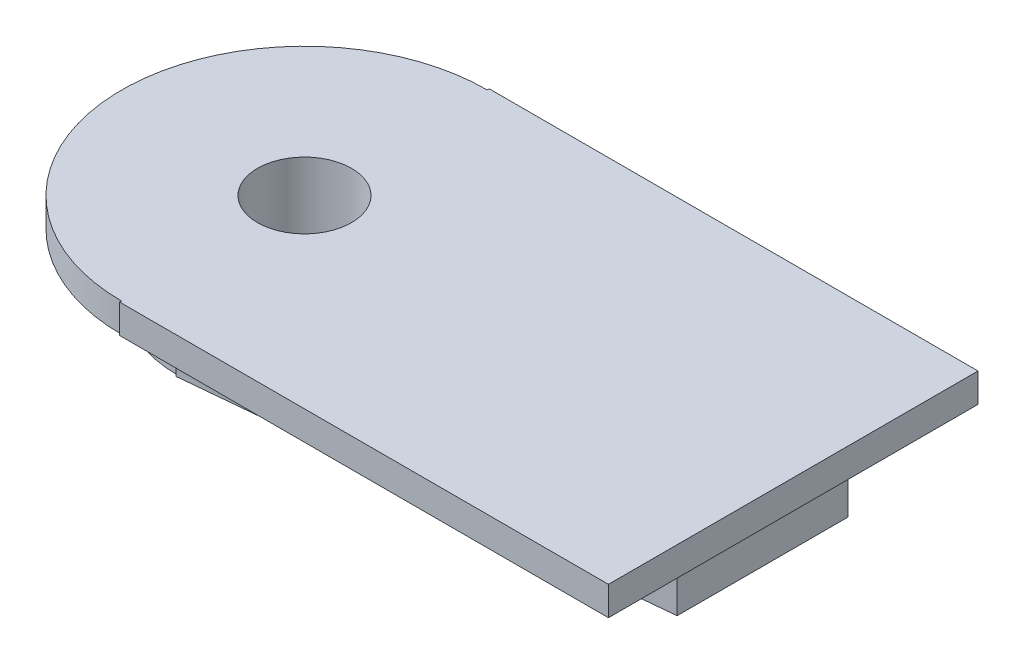
from build123d import *

# Parameters (mm, degrees)
BOSS_EXTRUDE1_START = 22.625
SKETCH1_R           = 3.5
BOSS_EXTRUDE1_DEPTH = 0.875
BOSS_EXTRUDE2_START = 22.625
BOSS_EXTRUDE2_DEPTH = 0.875
BOSS_EXTRUDE3_START = 23.9
SKETCH3_R           = 5.05
BOSS_EXTRUDE3_DEPTH = 0.4
BOSS_EXTRUDE4_START = 23.9
SKETCH4_W           = 13.5
SKETCH4_H           = 10.207569722
BOSS_EXTRUDE4_DEPTH = 0.4
CUT_EXTRUDE1_START  = 23.025
SKETCH5_R           = 1.3
CUT_EXTRUDE1_DEPTH  = 1.275


with BuildPart() as part:
    # Sketch1 → Boss-Extrude1 (new, symmetric)
    with BuildSketch(Plane(origin=(0, 0, 0), x_dir=(1, 0, 0), z_dir=(0, 1, 0)).offset(BOSS_EXTRUDE1_START)):
        with Locations(Location((0, 0, 0), (0, 0, 270))):
            Circle(SKETCH1_R)
    extrude(amount=BOSS_EXTRUDE1_DEPTH, both=True)

    # Sketch2 → Boss-Extrude2 (add, symmetric)
    with BuildSketch(Plane(origin=(0, 0, 0), x_dir=(1, 0, 0), z_dir=(0, 1, 0)).offset(BOSS_EXTRUDE2_START)):
        Polygon((0, -3.55356197), (12.65, -2.357784906), (12.65, 2.357784906), (0, 3.55356197), align=None)
    extrude(amount=BOSS_EXTRUDE2_DEPTH, both=True)

    # Sketch3 → Boss-Extrude3 (add, symmetric)
    with BuildSketch(Plane(origin=(0, 0, 0), x_dir=(1, 0, 0), z_dir=(0, 1, 0)).offset(BOSS_EXTRUDE3_START)):
        with Locations(Location((0, 0, 0), (0, 0, 39.071364061))):
            Circle(SKETCH3_R)
    extrude(amount=BOSS_EXTRUDE3_DEPTH, both=True)

    # Sketch4 → Boss-Extrude4 (add, symmetric)
    with BuildSketch(Plane(origin=(0, 0, 0), x_dir=(1, 0, 0), z_dir=(0, 1, 0)).offset(BOSS_EXTRUDE4_START)):
        with Locations((6.75, 0)):
            Rectangle(SKETCH4_W, SKETCH4_H)
    extrude(amount=BOSS_EXTRUDE4_DEPTH, both=True)

    # Sketch5 → Cut-Extrude1 (cut, symmetric)
    with BuildSketch(Plane(origin=(0, 0, 0), x_dir=(1, 0, 0), z_dir=(0, 1, 0)).offset(CUT_EXTRUDE1_START)):
        with Locations(Location((0, 0, 0), (0, 0, 270))):
            Circle(SKETCH5_R)
    extrude(amount=CUT_EXTRUDE1_DEPTH, both=True, mode=Mode.SUBTRACT)


solid = part.part
